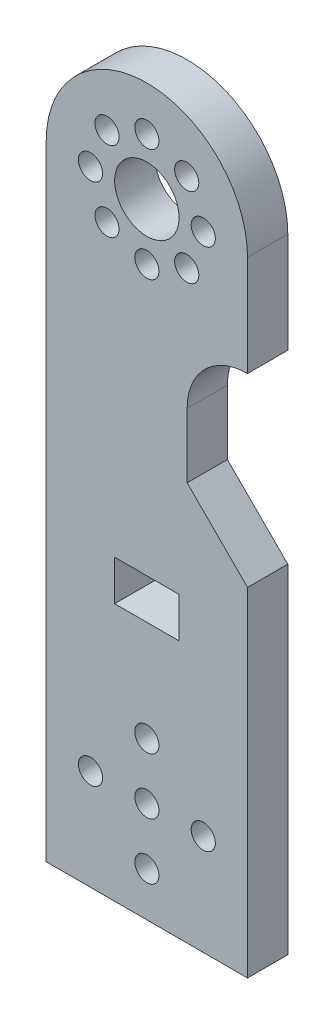
from build123d import *

# Parameters (mm, degrees)
SKETCH1_R           = 4
SKETCH1_R_2         = 1.5
BOSS_EXTRUDE1_DEPTH = 5
SKETCH2_W           = 8
SKETCH2_H           = 5
CUT_EXTRUDE1_DEPTH  = 10
SKETCH3_R           = 1.5
CUT_EXTRUDE2_DEPTH  = 10
CUT_EXTRUDE3_DEPTH  = 10


with BuildPart() as part:
    # Sketch1 → Boss-Extrude1 (new body)
    with BuildSketch(Plane.XY):
        with BuildLine():
            Line((-12.5, 0), (-12.5, -77.5))
            Line((-12.5, -77.5), (12.5, -77.5))
            Line((12.5, -77.5), (12.5, 0))
            ThreePointArc((12.5, 0), (0, 12.5), (-12.5, 0))
        make_face()
        Circle(SKETCH1_R, mode=Mode.SUBTRACT)
        with Locations((0, 7)):
            Circle(SKETCH1_R_2, mode=Mode.SUBTRACT)
        with Locations((4.949747468, 4.949747468)):
            Circle(SKETCH1_R_2, mode=Mode.SUBTRACT)
        with Locations((7, 0)):
            Circle(SKETCH1_R_2, mode=Mode.SUBTRACT)
        with Locations((4.949747468, -4.949747468)):
            Circle(SKETCH1_R_2, mode=Mode.SUBTRACT)
        with Locations((0, -7)):
            Circle(SKETCH1_R_2, mode=Mode.SUBTRACT)
        with Locations((-4.949747468, -4.949747468)):
            Circle(SKETCH1_R_2, mode=Mode.SUBTRACT)
        with Locations((-7, 0)):
            Circle(SKETCH1_R_2, mode=Mode.SUBTRACT)
        with Locations((-4.949747468, 4.949747468)):
            Circle(SKETCH1_R_2, mode=Mode.SUBTRACT)
    extrude(amount=BOSS_EXTRUDE1_DEPTH)

    # Sketch2 → Cut-Extrude1 (cut)
    with BuildSketch(Plane.XY.offset(5)):
        with Locations((0, -43)):
            Rectangle(SKETCH2_W, SKETCH2_H)
    extrude(amount=-CUT_EXTRUDE1_DEPTH, mode=Mode.SUBTRACT)

    # Sketch3 → Cut-Extrude2 (cut)
    with BuildSketch(Plane.XY.offset(5)):
        with Locations((0, -65)):
            Circle(SKETCH3_R)
        with Locations((0, -58)):
            Circle(SKETCH3_R)
        with Locations((-7, -65)):
            Circle(SKETCH3_R)
        with Locations((7, -65)):
            Circle(SKETCH3_R)
        with Locations((0, -72)):
            Circle(SKETCH3_R)
    extrude(amount=-CUT_EXTRUDE2_DEPTH, mode=Mode.SUBTRACT)

    # Sketch4 → Cut-Extrude3 (cut)
    with BuildSketch(Plane.XY.offset(5)):
        with BuildLine():
            Line((5, -20), (5, -28))
            Line((5, -28), (12.5, -35.5))
            Line((12.5, -35.5), (12.5, -27.5))
            ThreePointArc((12.5, -27.5), (17.803300859, -14.696699141), (5, -20))
        make_face()
    extrude(amount=-CUT_EXTRUDE3_DEPTH, mode=Mode.SUBTRACT)


solid = part.part
